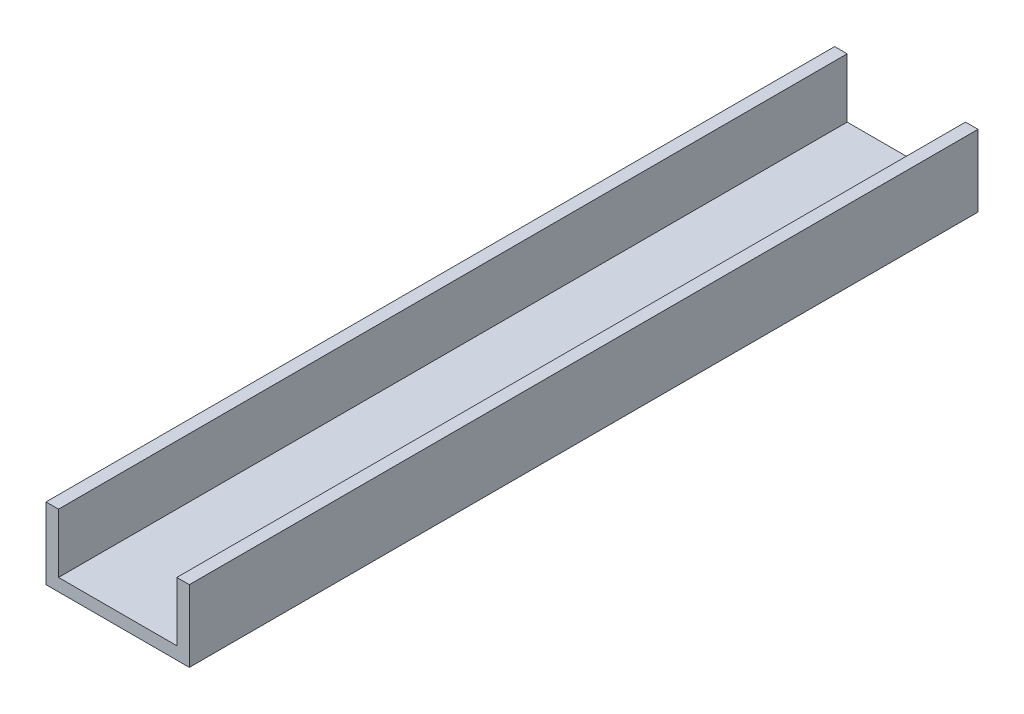
from build123d import *

# Parameters (mm, degrees)
SKETCH1_W           = 200
SKETCH1_H           = 3.175
BOSS_EXTRUDE1_DEPTH = 36.35
SKETCH2_W           = 3.175
SKETCH2_H           = 200
BOSS_EXTRUDE2_DEPTH = 15


with BuildPart() as part:
    # Sketch1 → Boss-Extrude1 (new body)
    with BuildSketch(Plane(origin=(0, 0, 0), x_dir=(0, 0, -1), z_dir=(1, 0, 0))):
        with Locations((100, 1.5875)):
            Rectangle(SKETCH1_W, SKETCH1_H)
    extrude(amount=BOSS_EXTRUDE1_DEPTH)

    # Sketch2 → Boss-Extrude2 (add)
    with BuildSketch(Plane(origin=(0, 3.175, 0), x_dir=(1, 0, 0), z_dir=(0, 1, 0))):
        with Locations((1.5875, 100)):
            Rectangle(SKETCH2_W, SKETCH2_H)
        with Locations((34.7625, 100)):
            Rectangle(SKETCH2_W, SKETCH2_H)
    extrude(amount=BOSS_EXTRUDE2_DEPTH)


solid = part.part
